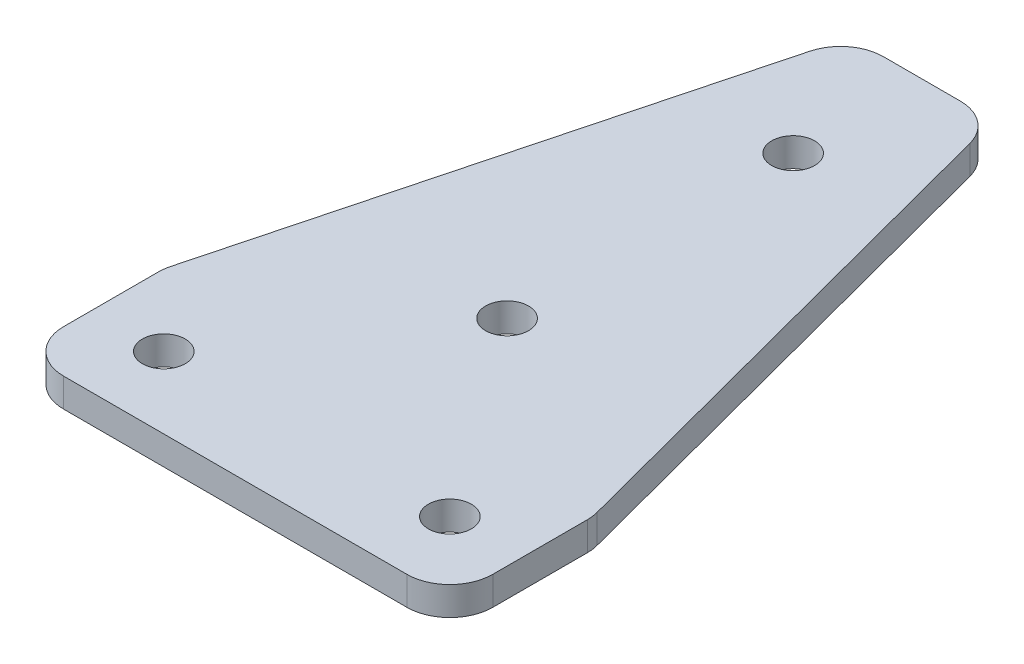
from build123d import *

# Parameters (mm, degrees)
SKETCH_1_R      = 1.5
EXTRUDE_1_DEPTH = 2
FILLET_1_R      = 3


with BuildPart() as part:
    # 草图1 → 凸台-拉伸1 (new body)
    with BuildSketch(Plane(origin=(0, 0, 0), x_dir=(1, 0, 0), z_dir=(0, 1, 0))):
        Polygon((-5, 48), (5, 48), (15, 10), (15, 0), (-15, 0), (-15, 10), align=None)
        with Locations(Location((0, 39, 0), (0, 0, 270))):
            Circle(SKETCH_1_R, mode=Mode.SUBTRACT)
        with Locations(Location((0, 19, 0), (0, 0, 270))):
            Circle(SKETCH_1_R, mode=Mode.SUBTRACT)
        with Locations(Location((10, 5, 0), (0, 0, 270))):
            Circle(SKETCH_1_R, mode=Mode.SUBTRACT)
        with Locations(Location((-10, 5, 0), (0, 0, 270))):
            Circle(SKETCH_1_R, mode=Mode.SUBTRACT)
    extrude(amount=EXTRUDE_1_DEPTH)

    # 圆角1
    fillet_1_edges = [part.edges().sort_by_distance(p)[0] for p in [
        (-5, 1, -48),
        (5, 1, -48),
        (15, 1, -10),
        (15, 1, 0),
        (-15, 1, 0),
        (-15, 1, -10),
    ]]
    fillet(fillet_1_edges, radius=FILLET_1_R)


solid = part.part
